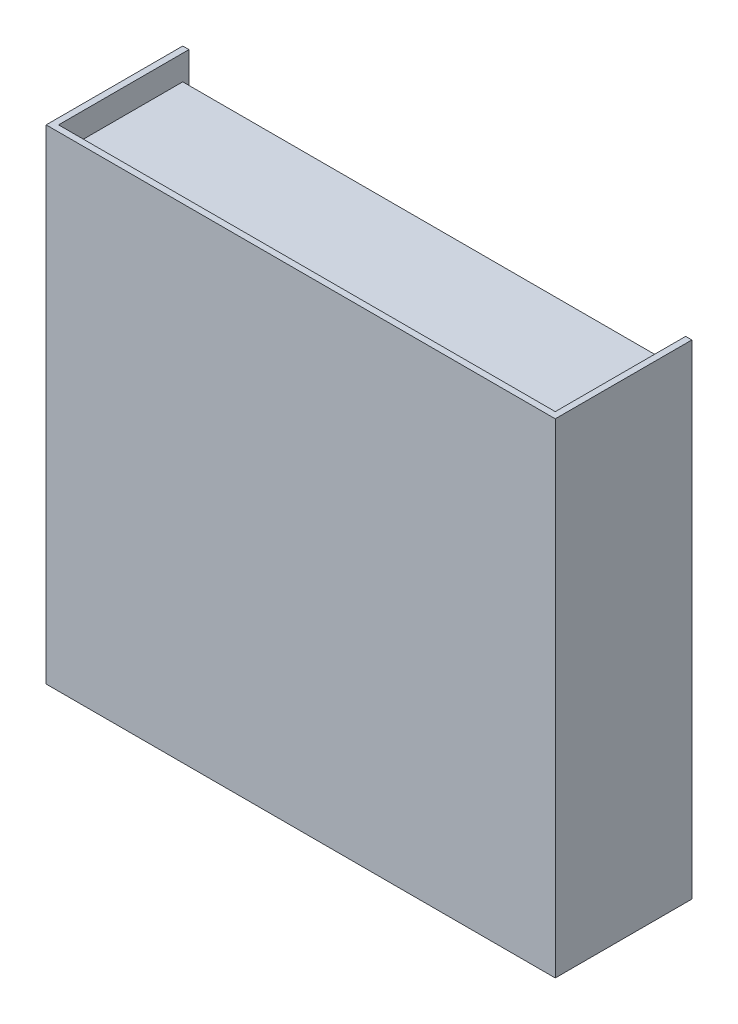
from build123d import *

# Parameters (mm, degrees)
SKETCH1_W            = 1016
SKETCH1_H            = 412.75
BOSS_EXTRUDE2_DEPTH  = 203.2
SKETCH3_W            = 1041.4
SKETCH3_H            = 939.8
BOSS_EXTRUDE4_DEPTH  = 25.4
SKETCH6_W            = 12.7
SKETCH6_H            = 939.8
BOSS_EXTRUDE7_DEPTH  = 50.8
SKETCH7_W            = 12.7
SKETCH7_H            = 939.8
BOSS_EXTRUDE8_DEPTH  = 50.8
BOSS_EXTRUDE9_DEPTH  = 50.8
SKETCH10_W           = 1016
SKETCH10_H           = 514.35
CUT_EXTRUDE1_DEPTH   = 50.8
SKETCH11_W           = 1016
SKETCH11_H           = 12.7
BOSS_EXTRUDE11_DEPTH = 38.1
SKETCH13_W           = 1016
SKETCH13_H           = 76.2
BOSS_EXTRUDE12_DEPTH = 12.7


with BuildPart() as part:
    # Sketch1 → Boss-Extrude2 (new body)
    with BuildSketch(Plane.XY):
        Polygon((-512.899336879, -399.978806382), (503.100663121, -399.978806382), (503.100663121, -463.478806382), (503.100663121, -476.178806382), (515.800663121, -476.178806382), (515.800663121, 463.621193618), (-525.599336879, 463.621193618), (-525.599336879, -476.178806382), (-512.899336879, -476.178806382), (-512.899336879, -463.478806382), align=None)
        with Locations((-4.899336879, 244.546193618)):
            Rectangle(SKETCH1_W, SKETCH1_H, mode=Mode.SUBTRACT)
        with Locations((-4.899336879, -180.903806382)):
            Rectangle(SKETCH1_W, SKETCH1_H, mode=Mode.SUBTRACT)
    extrude(amount=BOSS_EXTRUDE2_DEPTH)

    # Sketch3 → Boss-Extrude4 (add)
    with BuildSketch(Plane.XY.offset(203.2)):
        with Locations((-4.899336879, -6.278806382)):
            Rectangle(SKETCH3_W, SKETCH3_H)
    extrude(amount=BOSS_EXTRUDE4_DEPTH)

    # Sketch6 → Boss-Extrude7 (add)
    with BuildSketch(Plane(origin=(0, 0, 0), x_dir=(-1, 0, 0), z_dir=(0, 0, -1))):
        with Locations((-509.450663121, -6.278806382)):
            Rectangle(SKETCH6_W, SKETCH6_H)
    extrude(amount=BOSS_EXTRUDE7_DEPTH)

    # Sketch7 → Boss-Extrude8 (add)
    with BuildSketch(Plane(origin=(0, 0, 0), x_dir=(-1, 0, 0), z_dir=(0, 0, -1))):
        with Locations((519.249336879, -6.278806382)):
            Rectangle(SKETCH7_W, SKETCH7_H)
    extrude(amount=BOSS_EXTRUDE8_DEPTH)

    # Sketch8 → Boss-Extrude9 (add)
    with BuildSketch(Plane(origin=(0, 463.621193618, 0), x_dir=(1, 0, 0), z_dir=(0, 1, 0))):
        Polygon((-512.899336879, 0), (-512.899336879, -215.9), (503.100663121, -215.9), (503.100663121, 0), (503.100663121, 50.8), (515.800663121, 50.8), (515.800663121, 0), (515.800663121, -228.6), (-525.599336879, -228.6), (-525.599336879, 0), (-525.599336879, 50.8), (-512.899336879, 50.8), align=None)
    extrude(amount=BOSS_EXTRUDE9_DEPTH)

    # Sketch10 → Cut-Extrude1 (cut)
    with BuildSketch(Plane(origin=(0, 0, 0), x_dir=(-1, 0, 0), z_dir=(0, 0, -1))):
        with Locations((4.899336879, -219.003806382)):
            Rectangle(SKETCH10_W, SKETCH10_H)
    extrude(amount=-CUT_EXTRUDE1_DEPTH, mode=Mode.SUBTRACT)

    # Sketch11 → Boss-Extrude11 (add)
    with BuildSketch(Plane(origin=(0, 0, 0), x_dir=(-1, 0, 0), z_dir=(0, 0, -1))):
        with Locations((4.899336879, 457.271193618)):
            Rectangle(SKETCH11_W, SKETCH11_H)
    extrude(amount=BOSS_EXTRUDE11_DEPTH)

    # Sketch13 → Boss-Extrude12 (add)
    with BuildSketch(Plane(origin=(0, 0, 50.8), x_dir=(-1, 0, 0), z_dir=(0, 0, -1))):
        with Locations((4.899336879, 63.571193618)):
            Rectangle(SKETCH13_W, SKETCH13_H)
        with Locations((4.899336879, -361.878806382)):
            Rectangle(SKETCH13_W, SKETCH13_H)
    extrude(amount=-BOSS_EXTRUDE12_DEPTH)


solid = part.part
